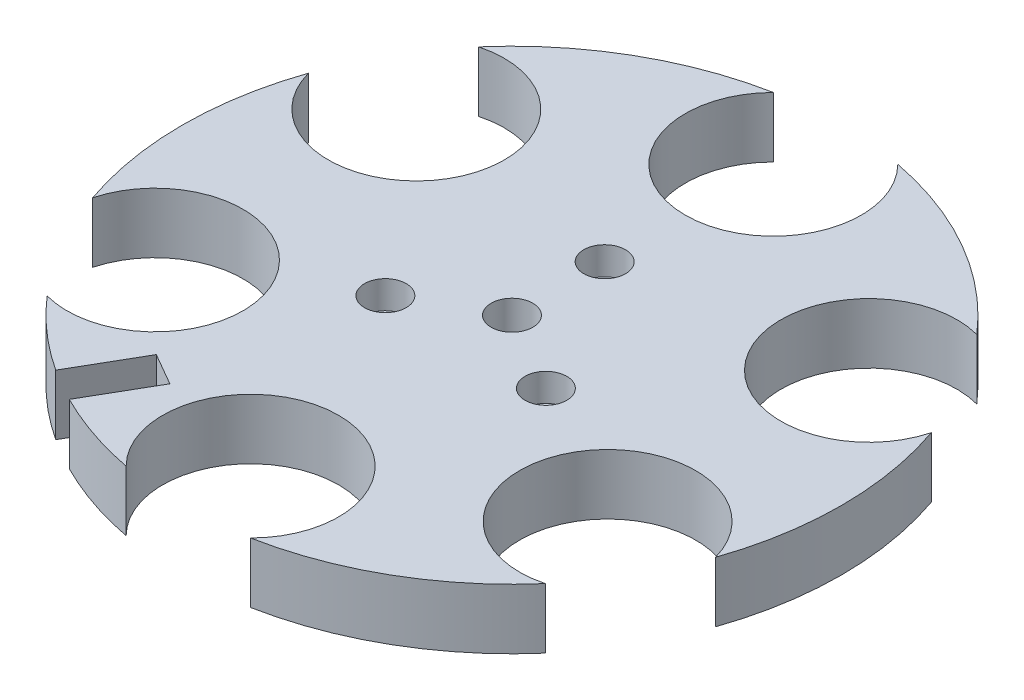
from build123d import *

# Parameters (mm, degrees)
SKETCH1_R               = 35.56
BOSS_EXTRUDE1_DEPTH     = 3.25
SKETCH2_R               = 9.5
CUT_EXTRUDE1_DEPTH      = 51.707762719
CIRPATTERN1_COUNT       = 6
SKETCH3_R               = 2.25
CUT_EXTRUDE2_DEPTH      = 3
CIRPATTERN2_COUNT       = 3
CUT_EXTRUDE3_DEPTH      = 51.261210864
CUT_EXTRUDE3_DEPTH_BACK = 51.261210864
SKETCH4_R               = 2.25
SKETCH5_R               = 2
BOSS_EXTRUDE2_DEPTH     = 2.5
CIRPATTERN3_COUNT       = 3
CUT_EXTRUDE4_DEPTH      = 51.261210864


with BuildPart() as part:
    # Sketch1 → Boss-Extrude1 (new, symmetric)
    with BuildSketch(Plane(origin=(0, 0, 0), x_dir=(1, 0, 0), z_dir=(0, 1, 0))):
        with Locations(Location((0, 0, 0), (0, 0, 90))):
            Circle(SKETCH1_R)
    extrude(amount=BOSS_EXTRUDE1_DEPTH, both=True)

    # Sketch2 → Cut-Extrude1 (cut, through all)
    with BuildSketch(Plane(origin=(0, 3.25, 0), x_dir=(1, 0, 0), z_dir=(0, 1, 0))):
        with Locations((0, 28.2)):
            Circle(SKETCH2_R)
    cut_extrude1 = extrude(amount=-CUT_EXTRUDE1_DEPTH, mode=Mode.SUBTRACT)

    # CirPattern1: Cut-Extrude1 ×6 about axis
    cirpattern1_axis = Axis((0, 0, 0), (0, 1, 0))
    for i in range(1, CIRPATTERN1_COUNT):
        add(cut_extrude1.rotate(cirpattern1_axis, i * 360 / CIRPATTERN1_COUNT), mode=Mode.SUBTRACT)

    # Sketch3 → Cut-Extrude2 (cut)
    with BuildSketch(Plane(origin=(0, 3.25, 0), x_dir=(1, 0, 0), z_dir=(0, 1, 0))):
        with Locations(Location((0, 10, 0), (0, 0, 270))):
            Circle(SKETCH3_R)
    cut_extrude2 = extrude(amount=-CUT_EXTRUDE2_DEPTH, mode=Mode.SUBTRACT)

    # CirPattern2: Cut-Extrude2 ×3 about axis
    cirpattern2_axis = Axis((0, 0, 0), (0, 1, 0))
    for i in range(1, CIRPATTERN2_COUNT):
        add(cut_extrude2.rotate(cirpattern2_axis, i * 360 / CIRPATTERN2_COUNT), mode=Mode.SUBTRACT)

    # Sketch4 → Cut-Extrude3 (cut, two sides: drawn at the far end of the back side and taken through both)
    with BuildSketch(Plane(origin=(0, 3.25, 0), x_dir=(1, 0, 0), z_dir=(0, 1, 0)).offset(-CUT_EXTRUDE3_DEPTH_BACK)):
        with Locations(Location((0, 0, 0), (0, 0, 270))):
            Circle(SKETCH4_R)
    extrude(amount=CUT_EXTRUDE3_DEPTH + CUT_EXTRUDE3_DEPTH_BACK, mode=Mode.SUBTRACT)

    # Sketch5 → Boss-Extrude2 (add)
    with BuildSketch(Plane(origin=(0, -3.25, 0), x_dir=(-1, 0, 0), z_dir=(0, -1, 0))):
        with Locations(Location((0, 10, 0), (0, 0, 270))):
            Circle(SKETCH5_R)
    boss_extrude2 = extrude(amount=BOSS_EXTRUDE2_DEPTH)

    # CirPattern3: Boss-Extrude2 ×3 about axis
    cirpattern3_axis = Axis((0, 0, 0), (0, 1, 0))
    for i in range(1, CIRPATTERN3_COUNT):
        add(boss_extrude2.rotate(cirpattern3_axis, i * 360 / CIRPATTERN3_COUNT))

    # Sketch6 → Cut-Extrude4 (cut, through all)
    with BuildSketch(Plane.XZ.offset(3.25)):
        Polygon((-12.047949192, 24.867660128), (-15.512050808, 22.867660128), (-19.512050808, 29.795863359), (-16.047949192, 31.795863359), align=None)
    extrude(amount=-CUT_EXTRUDE4_DEPTH, mode=Mode.SUBTRACT)


solid = part.part
